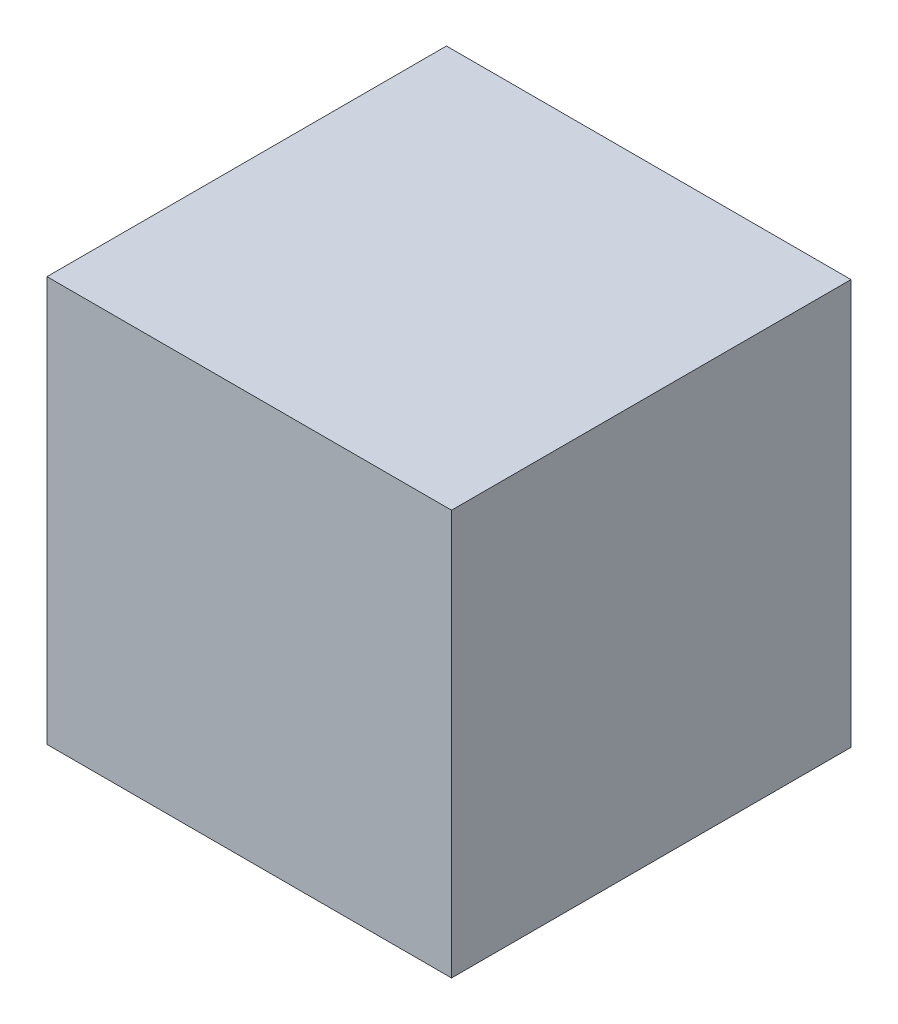
from build123d import *

# Parameters (mm, degrees)
SKETCH1_W           = 97.744340879
SKETCH1_H           = 97.888082556
BOSS_EXTRUDE1_DEPTH = 96.52


with BuildPart() as part:
    # Sketch1 → Boss-Extrude1 (new body)
    with BuildSketch(Plane.XY):
        with Locations((-36.025565616, -0.503095872)):
            Rectangle(SKETCH1_W, SKETCH1_H)
    extrude(amount=BOSS_EXTRUDE1_DEPTH)


solid = part.part
